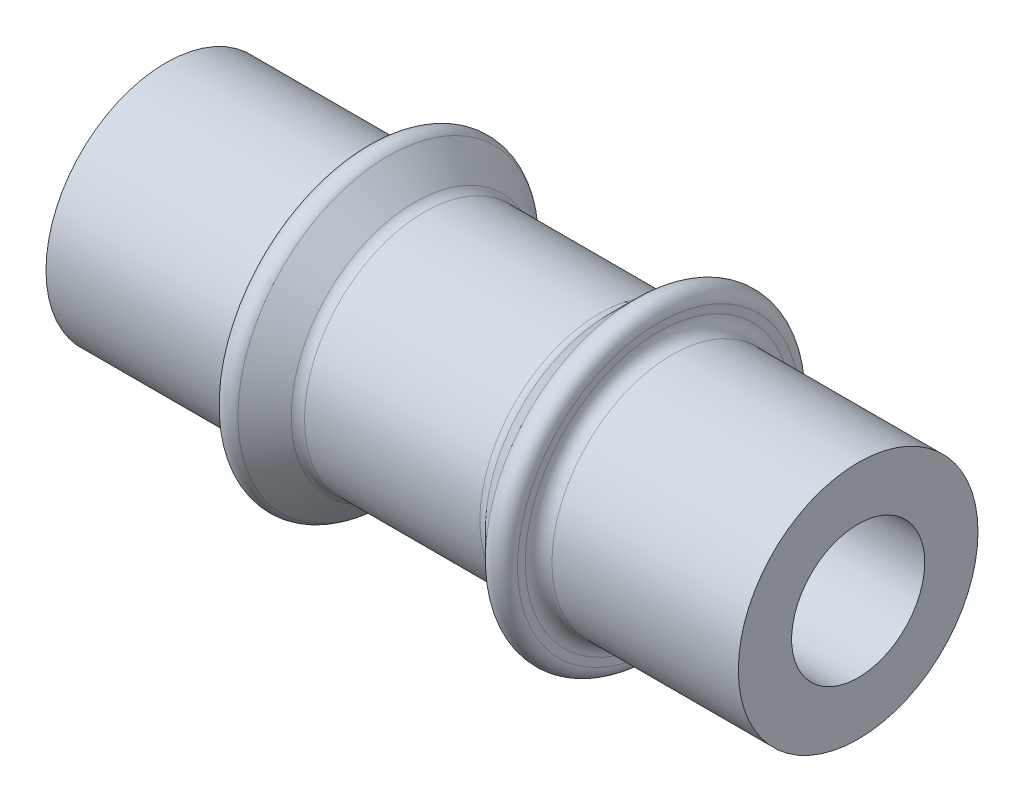
from build123d import *


with BuildPart() as part:
    # Sketch1 → Revolve1 (revolve)
    with BuildSketch(Plane.XY, mode=Mode.PRIVATE) as revolve1_sk:
        with BuildLine():
            Line((-26, 2.5), (0, 2.5))
            Line((0, 2.5), (0, 4.5))
            Line((0, 4.5), (-7, 4.5))
            ThreePointArc((-7, 4.5), (-7.353553391, 4.646446609), (-7.5, 5))
            Line((-7.5, 5), (-7.5, 5.292893219))
            ThreePointArc((-7.5, 5.292893219), (-7.808658284, 5.754832985), (-8.353553391, 5.646446609))
            Line((-8.353553391, 5.646446609), (-9.353553391, 4.646446609))
            ThreePointArc((-9.353553391, 4.646446609), (-9.515765065, 4.538060234), (-9.707106781, 4.5))
            Line((-9.707106781, 4.5), (-16.292893219, 4.5))
            ThreePointArc((-16.292893219, 4.5), (-16.484234935, 4.538060234), (-16.646446609, 4.646446609))
            Line((-16.646446609, 4.646446609), (-17.646446609, 5.646446609))
            ThreePointArc((-17.646446609, 5.646446609), (-18.191341716, 5.754832985), (-18.5, 5.292893219))
            Line((-18.5, 5.292893219), (-18.5, 5))
            ThreePointArc((-18.5, 5), (-18.646446609, 4.646446609), (-19, 4.5))
            Line((-19, 4.5), (-26, 4.5))
            Line((-26, 4.5), (-26, 2.5))
        make_face()
    revolve(revolve1_sk.sketch.rotate(Axis((0, 0, 0), (-1, 0, 0)), 90), axis=Axis((0, 0, 0), (-1, 0, 0)))


solid = part.part
